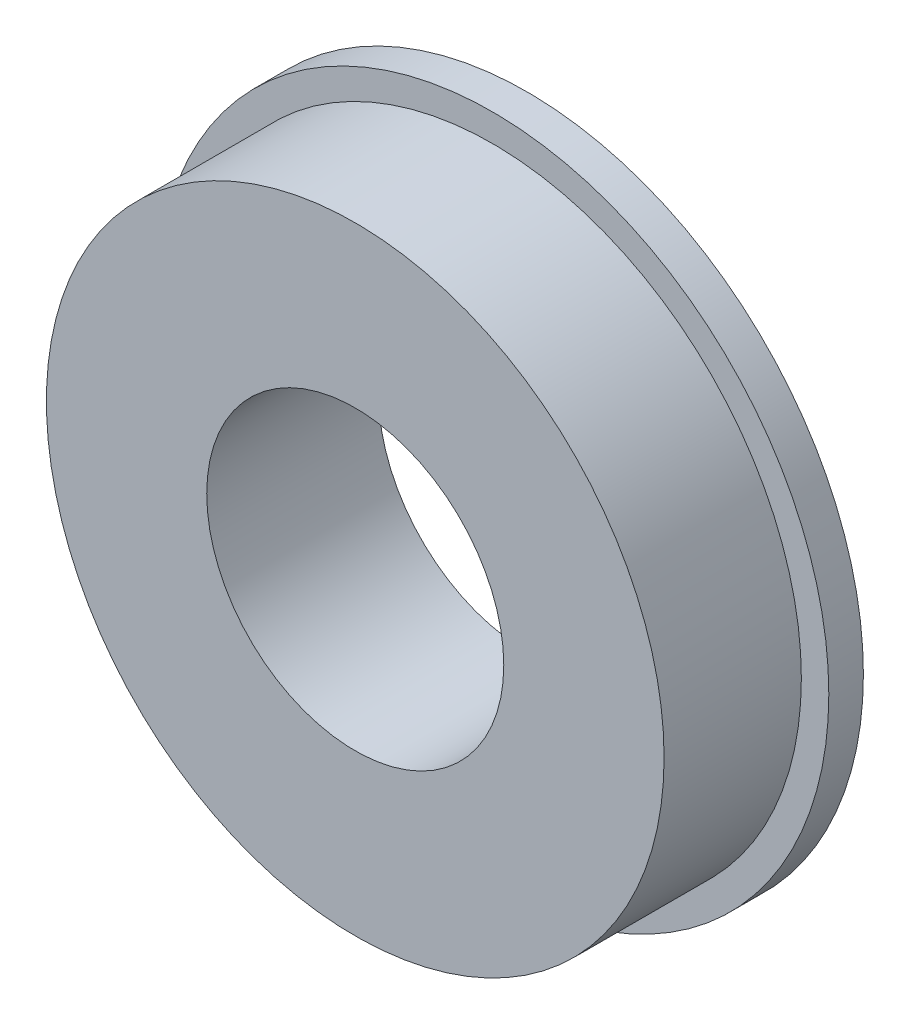
from build123d import *


with BuildPart() as part:
    # Sketch1 → Revolve1 (revolve)
    with BuildSketch(Plane(origin=(0, 0, 0), x_dir=(1, 0, 0), z_dir=(0, 1, 0)), mode=Mode.PRIVATE) as revolve1_sk:
        Polygon((0, 0), (2.8956, 0), (2.8956, -0.635), (5.7912, -0.635), (5.7912, 0), (8.6868, 0), (8.6868, -7.9502), (1.27, -7.9502), (1.27, -1.6002), (0, -1.6002), align=None)
    revolve(revolve1_sk.sketch.rotate(Axis((15.5575, 0, 1003.123726161), (0, 0, -1)), 180), axis=Axis((15.5575, 0, 1003.123726161), (0, 0, -1)))


solid = part.part
